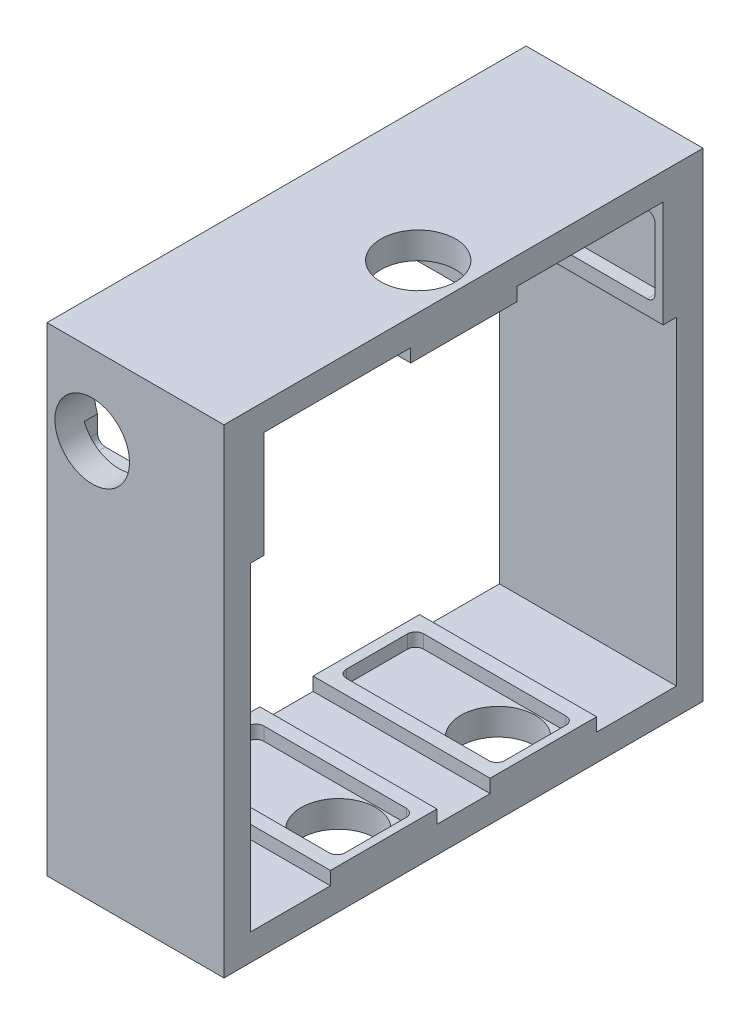
from build123d import *

# Parameters (mm, degrees)
SKETCH1_W           = 66.5
SKETCH1_H           = 180
BOSS_EXTRUDE1_DEPTH = 180
SKETCH3_W           = 160
SKETCH3_H           = 160
CUT_EXTRUDE1_DEPTH  = 180
SKETCH8_W           = 66.5
SKETCH8_H           = 40
BOSS_EXTRUDE2_DEPTH = 5
SKETCH10_W          = 66.5
SKETCH10_H          = 40
BOSS_EXTRUDE3_DEPTH = 5
SKETCH5_R           = 14
CUT_EXTRUDE3_DEPTH  = 10
SKETCH7_R           = 14
CUT_EXTRUDE4_DEPTH  = 10
CUT_EXTRUDE5_DEPTH  = 5
CUT_EXTRUDE6_START  = -5
CUT_EXTRUDE6_DEPTH  = 5
SKETCH12_W          = 66.5
SKETCH12_H          = 40
BOSS_EXTRUDE8_DEPTH = 5
SKETCH13_W          = 66.5
SKETCH13_H          = 40
BOSS_EXTRUDE9_DEPTH = 5
SKETCH15_R          = 14
CUT_EXTRUDE7_DEPTH  = 200


with BuildPart() as part:
    # Sketch1 → Boss-Extrude1 (new body)
    with BuildSketch(Plane.XY):
        with Locations((33.25, 90)):
            Rectangle(SKETCH1_W, SKETCH1_H)
    extrude(amount=BOSS_EXTRUDE1_DEPTH)

    # Sketch3 → Cut-Extrude1 (cut)
    with BuildSketch(Plane.ZY):
        with Locations((90, 90)):
            Rectangle(SKETCH3_W, SKETCH3_H)
    extrude(amount=-CUT_EXTRUDE1_DEPTH, mode=Mode.SUBTRACT)

    # Sketch8 → Boss-Extrude2 (add)
    with BuildSketch(Plane.XY.offset(10)):
        with Locations((33.25, 150)):
            Rectangle(SKETCH8_W, SKETCH8_H)
    extrude(amount=BOSS_EXTRUDE2_DEPTH)

    # Sketch10 → Boss-Extrude3 (add)
    with BuildSketch(Plane(origin=(0, 0, 170), x_dir=(-1, 0, 0), z_dir=(0, 0, -1))):
        with Locations((-33.25, 150)):
            Rectangle(SKETCH10_W, SKETCH10_H)
    extrude(amount=BOSS_EXTRUDE3_DEPTH)

    # Sketch5 → Cut-Extrude3 (cut)
    with BuildSketch(Plane(origin=(0, 180, 0), x_dir=(1, 0, 0), z_dir=(0, 1, 0))):
        with Locations(Location((49.5, -90, 0), (0, 0, 270))):
            Circle(SKETCH5_R)
    extrude(amount=-CUT_EXTRUDE3_DEPTH, mode=Mode.SUBTRACT)

    # Sketch7 → Cut-Extrude4 (cut)
    with BuildSketch(Plane.XZ):
        with Locations(Location((49.5, 60, 0), (0, 0, 270))):
            Circle(SKETCH7_R)
        with Locations(Location((49.5, 120, 0), (0, 0, 270))):
            Circle(SKETCH7_R)
    extrude(amount=-CUT_EXTRUDE4_DEPTH, mode=Mode.SUBTRACT)

    # Sketch9 → Cut-Extrude5 (cut)
    with BuildSketch(Plane.XY.offset(15)):
        with BuildLine():
            Line((60.5, 164.5), (7.5, 164.5))
            ThreePointArc((7.5, 164.5), (5.378679656, 163.621320344), (4.5, 161.5))
            Line((4.5, 161.5), (4.5, 138.5))
            ThreePointArc((4.5, 138.5), (5.378679656, 136.378679656), (7.5, 135.5))
            Line((7.5, 135.5), (60.5, 135.5))
            ThreePointArc((60.5, 135.5), (62.621320344, 136.378679656), (63.5, 138.5))
            Line((63.5, 138.5), (63.5, 161.5))
            ThreePointArc((63.5, 161.5), (62.621320344, 163.621320344), (60.5, 164.5))
        make_face()
    extrude(amount=-CUT_EXTRUDE5_DEPTH, mode=Mode.SUBTRACT)

    # Sketch11 → Cut-Extrude6 (cut)
    with BuildSketch(Plane(origin=(0, 0, 165), x_dir=(-1, 0, 0), z_dir=(0, 0, -1)).offset(CUT_EXTRUDE6_START)):
        with BuildLine():
            Line((-60.5, 164.5), (-7, 164.5))
            ThreePointArc((-7, 164.5), (-4.878679656, 163.621320344), (-4, 161.5))
            Line((-4, 161.5), (-4, 138.5))
            ThreePointArc((-4, 138.5), (-4.878679656, 136.378679656), (-7, 135.5))
            Line((-7, 135.5), (-60.5, 135.5))
            ThreePointArc((-60.5, 135.5), (-62.621320344, 136.378679656), (-63.5, 138.5))
            Line((-63.5, 138.5), (-63.5, 161.5))
            ThreePointArc((-63.5, 161.5), (-62.621320344, 163.621320344), (-60.5, 164.5))
        make_face()
    extrude(amount=CUT_EXTRUDE6_DEPTH, mode=Mode.SUBTRACT)

    # Sketch12 → Boss-Extrude8 (add)
    with BuildSketch(Plane.XZ.offset(-170)):
        with Locations((33.25, 89.833476808)):
            Rectangle(SKETCH12_W, SKETCH12_H)
        with BuildLine():
            Line((60.5, 75.333476808), (7, 75.333476808))
            ThreePointArc((7, 75.333476808), (4.878679656, 76.212156465), (4, 78.333476808))
            Line((4, 78.333476808), (4, 101.333476808))
            ThreePointArc((4, 101.333476808), (4.878679656, 103.454797152), (7, 104.333476808))
            Line((7, 104.333476808), (60.5, 104.333476808))
            ThreePointArc((60.5, 104.333476808), (62.621320344, 103.454797152), (63.5, 101.333476808))
            Line((63.5, 101.333476808), (63.5, 78.333476808))
            ThreePointArc((63.5, 78.333476808), (62.621320344, 76.212156465), (60.5, 75.333476808))
        make_face(mode=Mode.SUBTRACT)
    extrude(amount=BOSS_EXTRUDE8_DEPTH)

    # Sketch13 → Boss-Extrude9 (add)
    # profile 1 of 2: a face of its own
    with BuildSketch(Plane(origin=(0, 10, 0), x_dir=(1, 0, 0), z_dir=(0, 1, 0))):
        with Locations((33.25, -120)):
            Rectangle(SKETCH13_W, SKETCH13_H)
        with BuildLine():
            Line((7, -134.5), (60.5, -134.5))
            ThreePointArc((60.5, -134.5), (62.621320344, -133.621320344), (63.5, -131.5))
            Line((63.5, -131.5), (63.5, -108.5))
            ThreePointArc((63.5, -108.5), (62.621320344, -106.378679656), (60.5, -105.5))
            Line((60.5, -105.5), (7, -105.5))
            ThreePointArc((7, -105.5), (4.878679656, -106.378679656), (4, -108.5))
            Line((4, -108.5), (4, -131.5))
            ThreePointArc((4, -131.5), (4.878679656, -133.621320344), (7, -134.5))
        make_face(mode=Mode.SUBTRACT)
    # profile 2 of 2: a face of its own
    with BuildSketch(Plane(origin=(0, 10, 0), x_dir=(1, 0, 0), z_dir=(0, 1, 0))):
        with Locations((33.25, -60)):
            Rectangle(SKETCH13_W, SKETCH13_H)
        with BuildLine():
            Line((7, -74.5), (60.5, -74.5))
            ThreePointArc((60.5, -74.5), (62.621320344, -73.621320344), (63.5, -71.5))
            Line((63.5, -71.5), (63.5, -48.5))
            ThreePointArc((63.5, -48.5), (62.621320344, -46.378679656), (60.5, -45.5))
            Line((60.5, -45.5), (7, -45.5))
            ThreePointArc((7, -45.5), (4.878679656, -46.378679656), (4, -48.5))
            Line((4, -48.5), (4, -71.5))
            ThreePointArc((4, -71.5), (4.878679656, -73.621320344), (7, -74.5))
        make_face(mode=Mode.SUBTRACT)
    extrude(amount=BOSS_EXTRUDE9_DEPTH)

    # Sketch15 → Cut-Extrude7 (cut)
    with BuildSketch(Plane(origin=(0, 0, 0), x_dir=(-1, 0, 0), z_dir=(0, 0, -1))):
        with Locations((-17, 150)):
            Circle(SKETCH15_R)
    extrude(amount=-CUT_EXTRUDE7_DEPTH, mode=Mode.SUBTRACT)


solid = part.part
